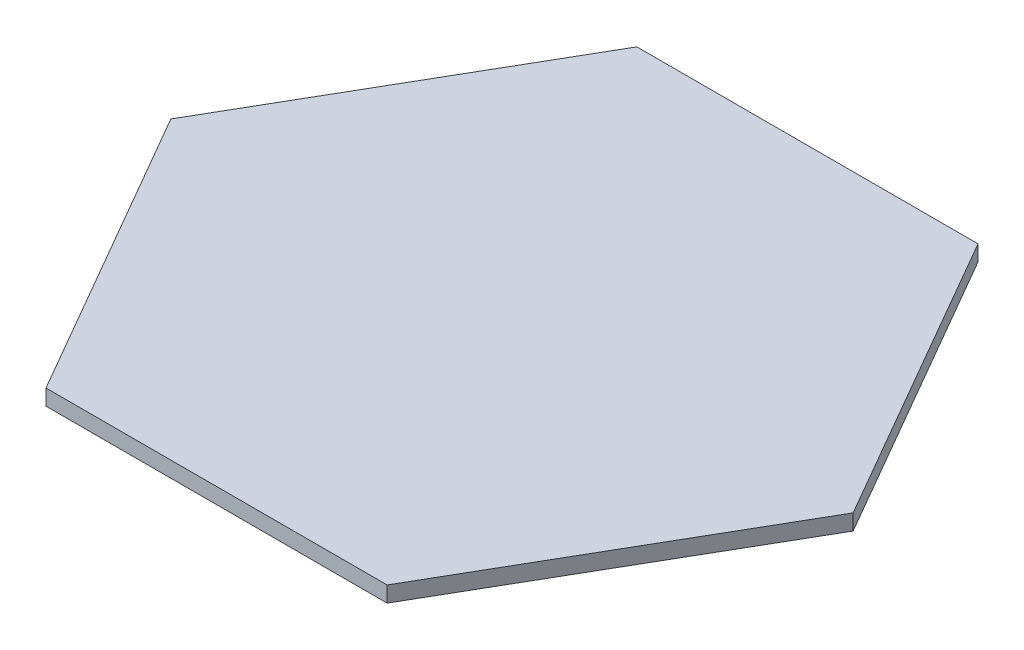
from build123d import *

# Parameters (mm, degrees)
EXTRUDE_1_DEPTH = 3


with BuildPart() as part:
    # 草图1 → 凸台-拉伸1 (new body)
    with BuildSketch(Plane(origin=(0, 0, 0), x_dir=(1, 0, 0), z_dir=(0, 1, 0))):
        Polygon((65, 0), (32.5, 56.291651246), (-32.5, 56.291651246), (-65, 0), (-32.5, -56.291651246), (32.5, -56.291651246), align=None)
    extrude(amount=EXTRUDE_1_DEPTH)


solid = part.part
